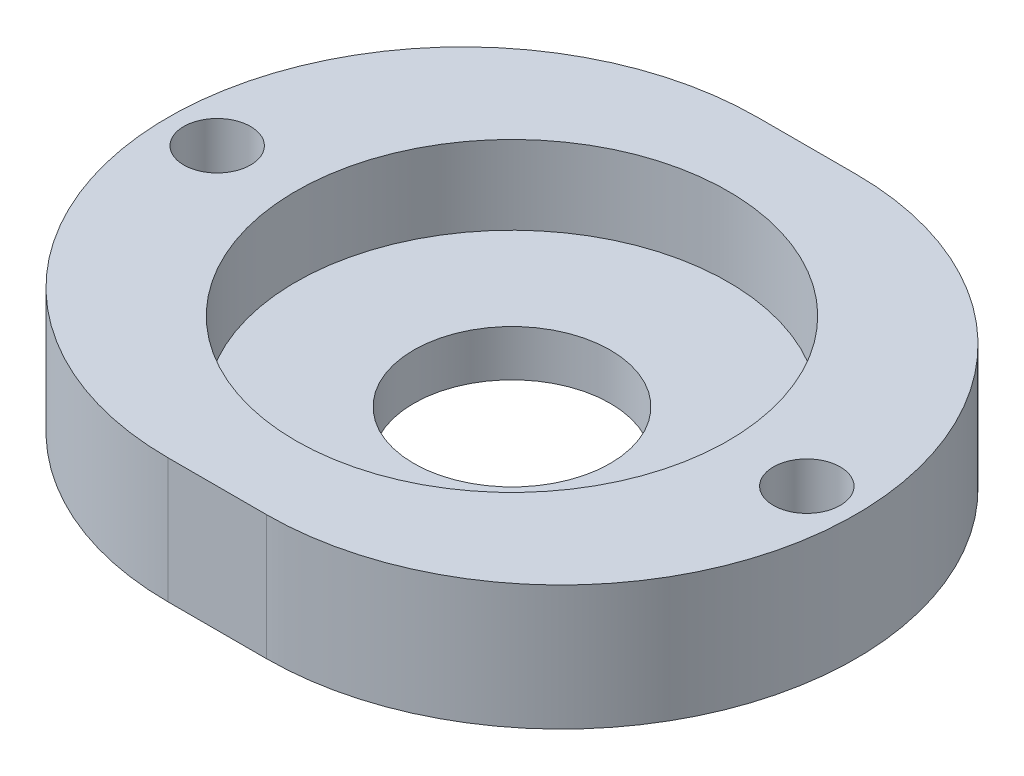
from build123d import *

# Parameters (mm, degrees)
SKETCH3_R            = 5
BOSS_EXTRUDE1_DEPTH  = 6.35
SKETCH4_R            = 11
CUT_EXTRUDE1_DEPTH   = 4
M3_CLEARANCE_HOLE1_D = 3.4


with BuildPart() as part:
    # Sketch3 → Boss-Extrude1 (new body)
    with BuildSketch(Plane(origin=(0, 0, 0), x_dir=(1, 0, 0), z_dir=(0, 1, 0))):
        with BuildLine():
            Line((0, 0), (5, 0))
            ThreePointArc((5, 0), (20, 15), (5, 30))
            Line((5, 30), (0, 30))
            ThreePointArc((0, 30), (-15, 15), (0, 0))
        make_face()
        with Locations(Location((2.5, 15, 0), (0, 0, 270))):
            Circle(SKETCH3_R, mode=Mode.SUBTRACT)
    extrude(amount=BOSS_EXTRUDE1_DEPTH)

    # Sketch4 → Cut-Extrude1 (cut)
    with BuildSketch(Plane(origin=(0, 6.35, 0), x_dir=(1, 0, 0), z_dir=(0, 1, 0))):
        with Locations(Location((2.5, 15, 0), (0, 0, 270))):
            Circle(SKETCH4_R)
    extrude(amount=-CUT_EXTRUDE1_DEPTH, mode=Mode.SUBTRACT)

    # M3 Clearance Hole1 (through all)
    with Locations(Plane(origin=(-12.5, 6.35, -15), x_dir=(0, 0, 1), z_dir=(0, 1, 0))):
        with Locations((0, 0), (0, 30)):
            Hole(M3_CLEARANCE_HOLE1_D / 2)


solid = part.part
